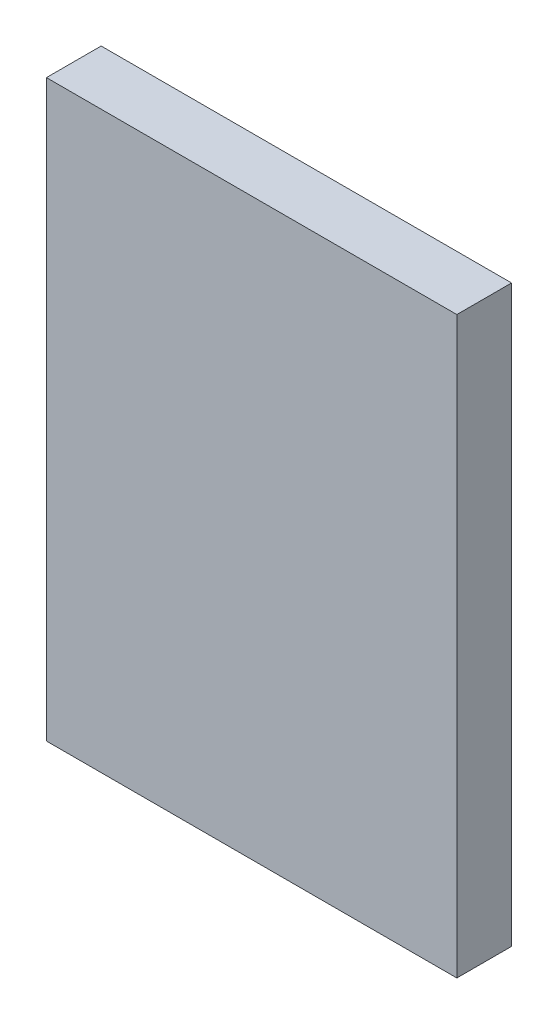
from build123d import *

# Parameters (mm, degrees)
CROQUIS1_W              = 30
CROQUIS1_H              = 42
SALIENTE_EXTRUIR1_DEPTH = 4


with BuildPart() as part:
    # Croquis1 → Saliente-Extruir1 (new body)
    with BuildSketch(Plane.XY):
        with Locations((15, -21)):
            Rectangle(CROQUIS1_W, CROQUIS1_H)
    extrude(amount=SALIENTE_EXTRUIR1_DEPTH)


solid = part.part
